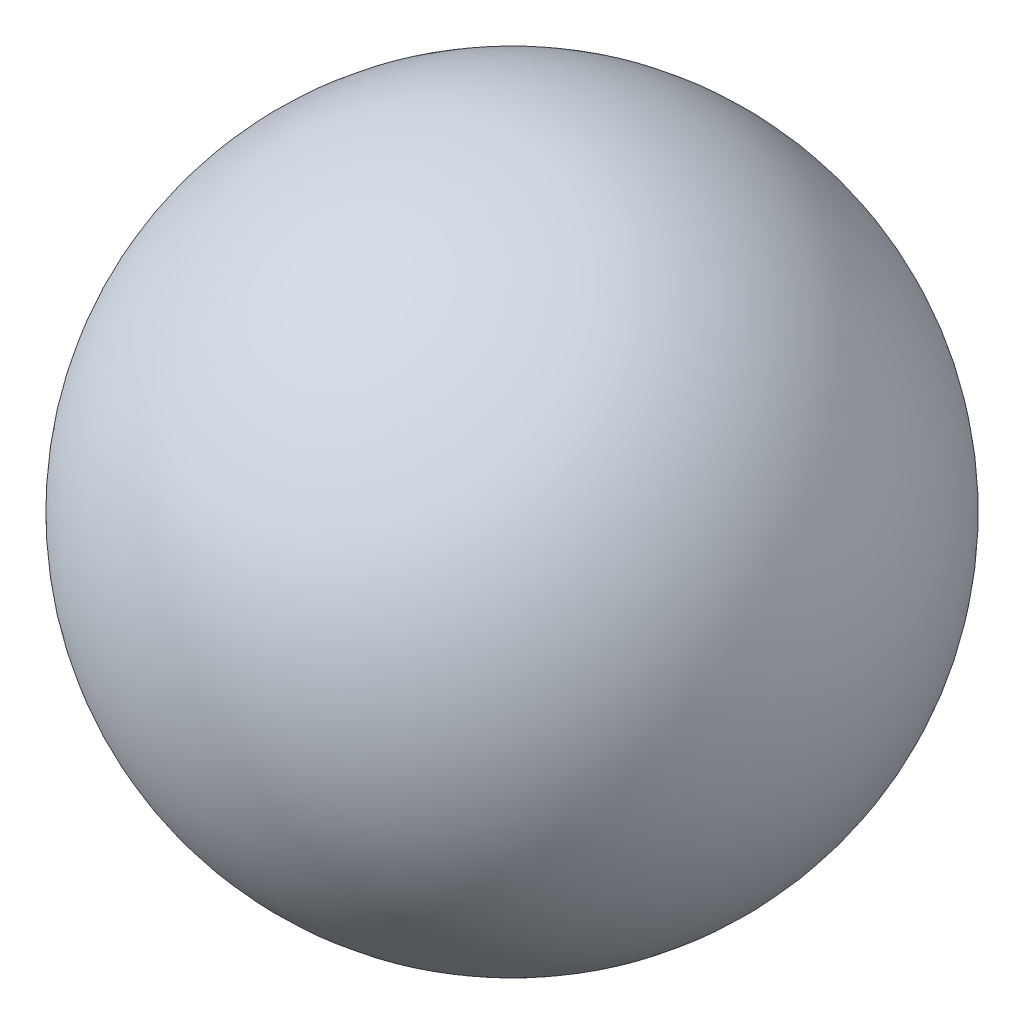
from build123d import *


with BuildPart() as part:
    # Sketch1 → Base-Revolve (revolve)
    with BuildSketch(Plane.XY):
        with BuildLine():
            Line((0, 0), (0, 272.183421777))
            ThreePointArc((0, 272.183421777), (136.091710888, 136.091710888), (0, 0))
        make_face()
    revolve(axis=Axis((0, 113.28554095, 0), (0, -1, 0)))


solid = part.part
